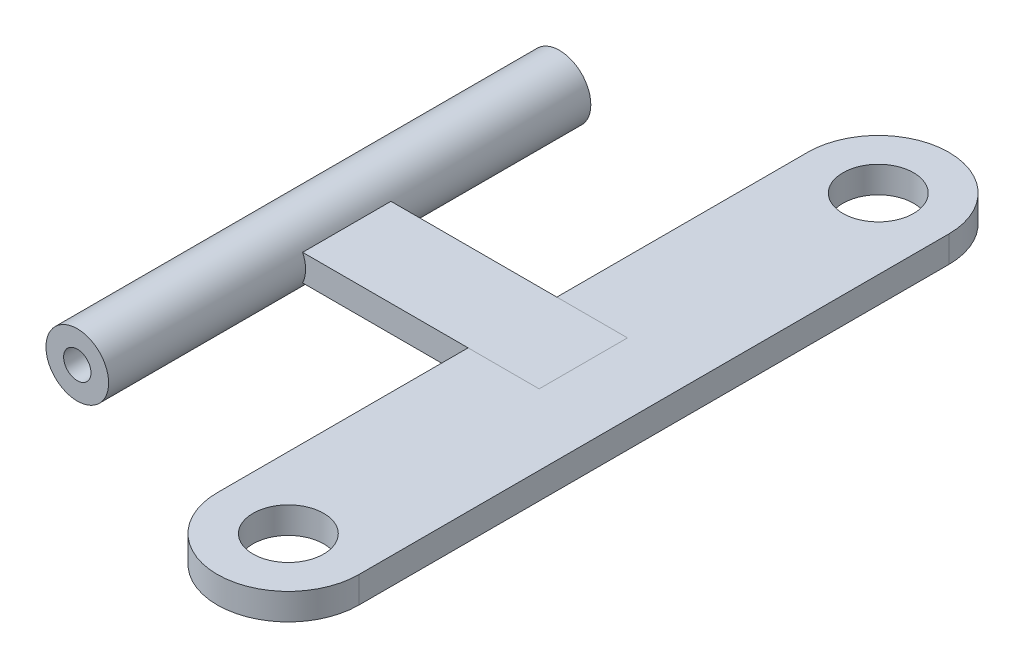
from build123d import *

# Parameters (mm, degrees)
BOSS_EXTRUDE1_DEPTH      = 34.671
BOSS_EXTRUDE1_DEPTH_BACK = 34.671
SKETCH1_R                = 4.5085
SKETCH1_R_2              = 1.9685
BOSS_EXTRUDE2_DEPTH      = 6.35
BOSS_EXTRUDE2_DEPTH_BACK = 6.35
SKETCH3_W                = 36.1315
SKETCH3_H                = 3.81
SKETCH5_R                = 5.08
BOSS_EXTRUDE3_DEPTH      = 3.81


with BuildPart() as part:
    # Sketch1 → Boss-Extrude1 (new, two sides: drawn at the far end of the back side and taken through both)
    with BuildSketch(Plane.XY.offset(-BOSS_EXTRUDE1_DEPTH_BACK)):
        Circle(SKETCH1_R)
        Circle(SKETCH1_R_2, mode=Mode.SUBTRACT)
    extrude(amount=BOSS_EXTRUDE1_DEPTH + BOSS_EXTRUDE1_DEPTH_BACK)

    # Sketch3 → Boss-Extrude2 (add, two sides: drawn at the far end of the back side and taken through both)
    with BuildSketch(Plane.XY.offset(-BOSS_EXTRUDE2_DEPTH_BACK)):
        with Locations((20.03425, 0)):
            Rectangle(SKETCH3_W, SKETCH3_H)
    extrude(amount=BOSS_EXTRUDE2_DEPTH + BOSS_EXTRUDE2_DEPTH_BACK)


with BuildPart() as body_2:
    # Sketch5 → Boss-Extrude3 (new body)
    with BuildSketch(Plane(origin=(0, 1.905, 0), x_dir=(1, 0, 0), z_dir=(0, 1, 0))):
        with BuildLine():
            Line((27.880519362, -42.418), (27.880519362, -6.35))
            Line((27.880519362, -6.35), (38.1, -6.35))
            Line((38.1, -6.35), (38.1, 6.35))
            Line((38.1, 6.35), (27.94, 6.35))
            Line((27.94, 6.35), (27.94, 42.418))
            ThreePointArc((27.94, 42.418), (38.1, 52.578), (48.26, 42.418))
            Line((48.26, 42.418), (48.26, -42.418))
            ThreePointArc((48.26, -42.418), (38.070259681, -52.607740319), (27.880519362, -42.418))
        make_face()
        with Locations(Location((38.1, -42.418, 0), (0, 0, 180))):
            Circle(SKETCH5_R, mode=Mode.SUBTRACT)
        with Locations(Location((38.1, 42.418, 0), (0, 0, 180))):
            Circle(SKETCH5_R, mode=Mode.SUBTRACT)
    extrude(amount=-BOSS_EXTRUDE3_DEPTH)


solid = Compound([part.part, body_2.part])
